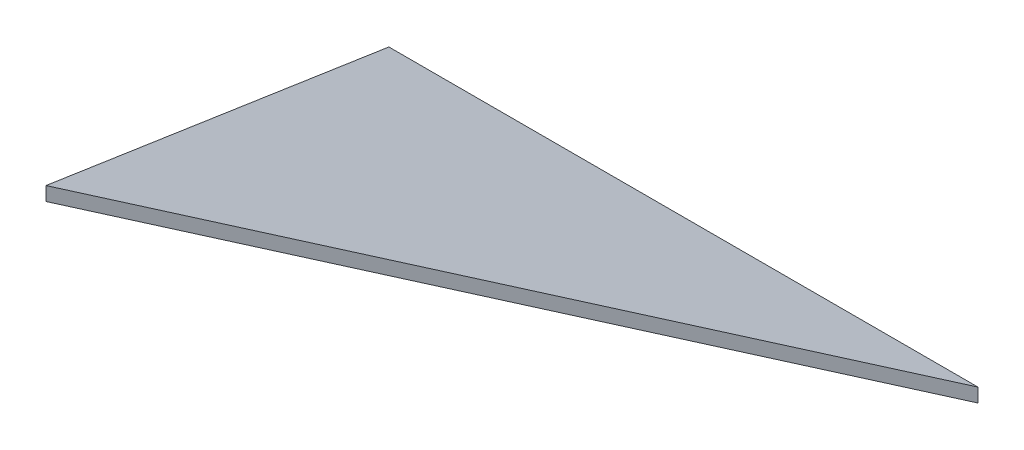
from build123d import *

# Parameters (mm, degrees)
BOSS_EXTRUDE1_DEPTH = 152.4
SKETCH3_OUTSIDE_W   = 273.93
SKETCH3_OUTSIDE_H   = 229.576
CUT_EXTRUDE2_DEPTH  = 381.660734008
SHELL1_T            = -6.35
CUT_EXTRUDE3_DEPTH  = 381.660734008


with BuildPart() as part:
    # Sketch2 → Boss-Extrude1 (new body)
    with BuildSketch(Plane(origin=(0, 0, 0), x_dir=(1, 0, 0), z_dir=(0, 1, 0))):
        Polygon((-57.15, 0), (224.536, 0), (-24.357683353, -196.753899884), align=None)
    extrude(amount=BOSS_EXTRUDE1_DEPTH)

    # Sketch3 outside → Cut-Extrude2 (cut, through all)
    with BuildSketch(Plane(origin=(-63.5, 0, 0), x_dir=(0, 0, -1), z_dir=(1, 0, 0))):
        with Locations((-98.377, 76.2)):
            Rectangle(SKETCH3_OUTSIDE_W, SKETCH3_OUTSIDE_H)
        Polygon((0, 152.4), (-152.4, 107.95), (-261.257142857, 76.2), (-152.4, 44.45), (0, 0), align=None, mode=Mode.SUBTRACT)
    extrude(amount=CUT_EXTRUDE2_DEPTH, mode=Mode.SUBTRACT)

    # Shell1
    shell1_openings = [part.faces().sort_by_distance(p)[0] for p in [
        (83.693, 76.2, 0),
    ]]
    offset(amount=SHELL1_T, openings=shell1_openings, kind=Kind.INTERSECTION)

    # Sketch4 → Cut-Extrude3 (cut, through all)
    with BuildSketch(Plane(origin=(-63.5, 0, 0), x_dir=(0, 0, -1), z_dir=(1, 0, 0))):
        Polygon((0, 274.61160546), (-196.753899884, 217.225051327), (-196.753899884, 64.001137466), (0, 6.614583333), align=None)
    extrude(amount=CUT_EXTRUDE3_DEPTH, mode=Mode.SUBTRACT)


solid = part.part
